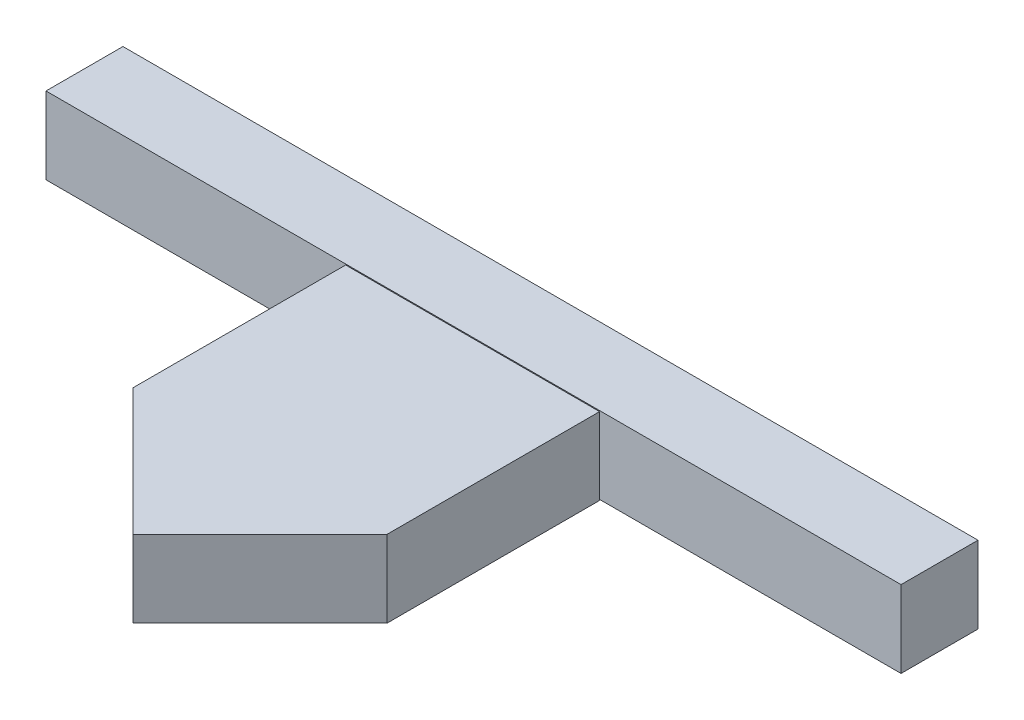
from build123d import *

# Parameters (mm, degrees)
BOSS_EXTRUDE1_DEPTH   = 9
SKETCH1_W             = 100
SKETCH1_H             = 9
BOSS_EXTRUDE1_2_DEPTH = 9


with BuildPart() as part:
    # Sketch1 → Boss-Extrude1 (new body)
    with BuildSketch(Plane(origin=(0, 0, 0), x_dir=(1, 0, 0), z_dir=(0, 1, 0))):
        Polygon((-14.849242405, 0), (-14.849242405, 24.849242405), (14.849242405, 24.849242405), (14.849242405, 0), (0, -14.849242405), align=None)
    extrude(amount=BOSS_EXTRUDE1_DEPTH)


with BuildPart() as body_2:
    # Sketch1 → Boss-Extrude1 2 (new body)
    with BuildSketch(Plane(origin=(0, 0, 0), x_dir=(1, 0, 0), z_dir=(0, 1, 0))):
        with Locations((0, 29.457275469)):
            Rectangle(SKETCH1_W, SKETCH1_H)
    extrude(amount=BOSS_EXTRUDE1_2_DEPTH)


solid = Compound([part.part, body_2.part])
